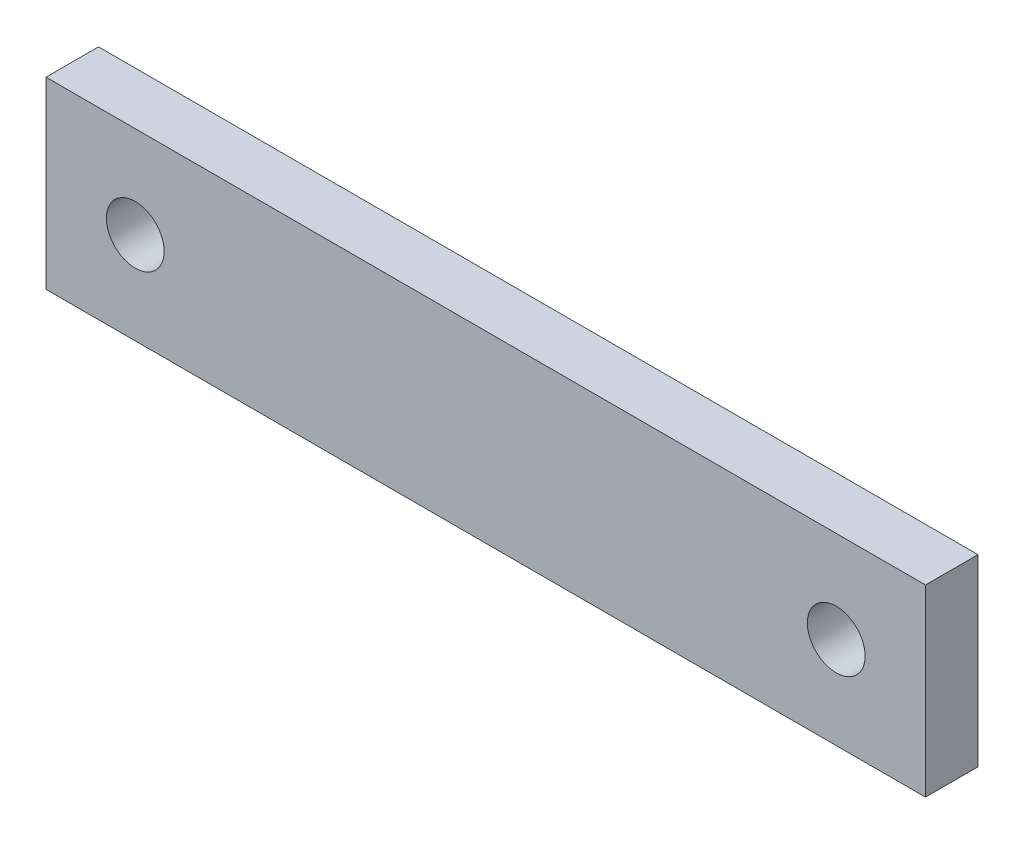
from build123d import *

# Parameters (mm, degrees)
SKETCH_1_W          = 335
SKETCH_1_H          = 70
EXTRUDE_1_DEPTH     = 20
SKETCH_2_R          = 11
CUT_EXTRUDE_1_DEPTH = 343.819194328


with BuildPart() as part:
    # 草图1 → 凸台-拉伸1 (new body)
    with BuildSketch(Plane.XY):
        with Locations((167.5, 35)):
            Rectangle(SKETCH_1_W, SKETCH_1_H)
    extrude(amount=EXTRUDE_1_DEPTH)

    # 草图2 → 切除-拉伸1 (cut, through all)
    with BuildSketch(Plane.XY.offset(20)):
        with Locations((34, 35)):
            Circle(SKETCH_2_R)
        with Locations((301, 35)):
            Circle(SKETCH_2_R)
    extrude(amount=-CUT_EXTRUDE_1_DEPTH, mode=Mode.SUBTRACT)


solid = part.part
